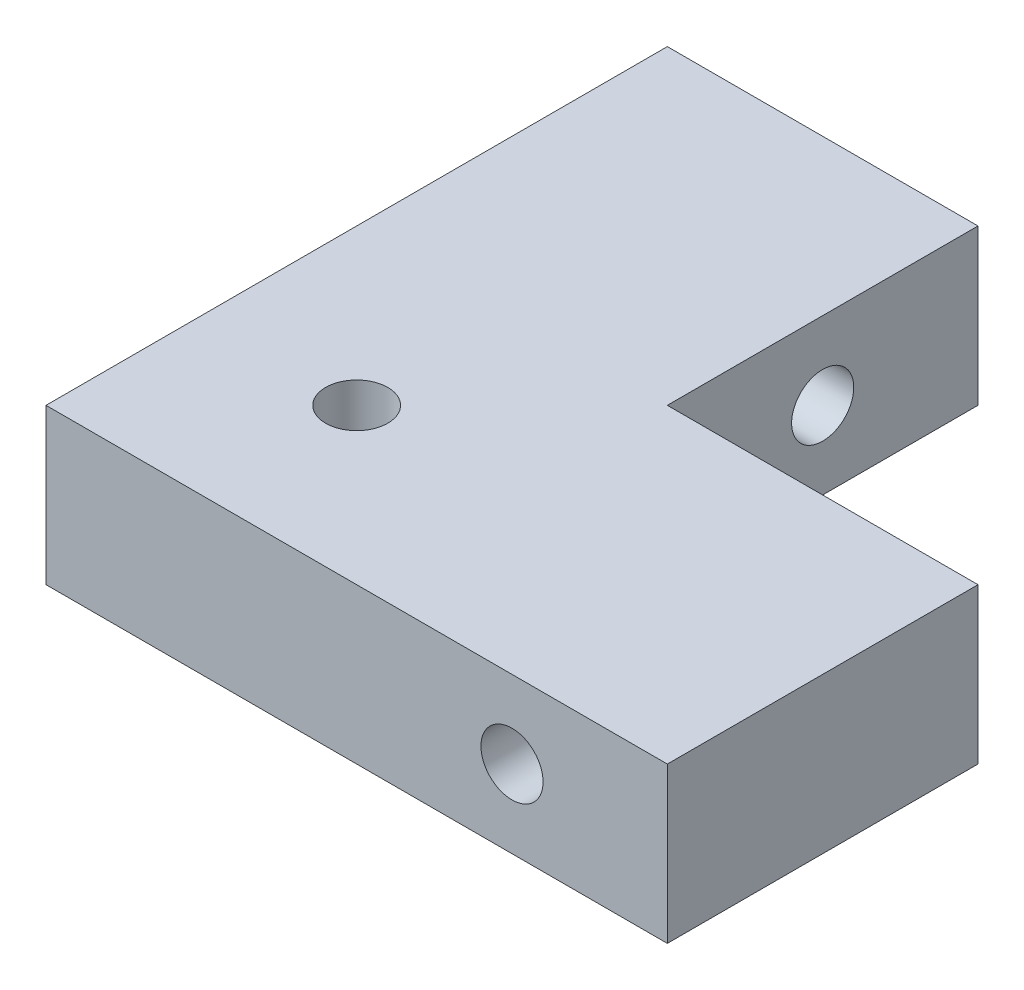
from build123d import *

# Parameters (mm, degrees)
RESSALTO_EXTRUS_O1_DEPTH = 20
ESBO_O3_R                = 4
CORTE_EXTRUS_O1_DEPTH    = 63.524475359
ESBO_O4_R                = 4
CORTE_EXTRUS_O2_DEPTH    = 84.066238629
ESBO_O5_R                = 4
CORTE_EXTRUS_O3_DEPTH    = 85.907655832


with BuildPart() as part:
    # Esboço1 → Ressalto-extrusão1 (new body)
    with BuildSketch(Plane(origin=(0, 0, 0), x_dir=(1, 0, 0), z_dir=(0, 1, 0))):
        Polygon((-70, 36.304347826), (-70, -43.695652174), (10, -43.695652174), (10, -3.695652174), (-30, -3.695652174), (-30, 36.304347826), align=None)
    extrude(amount=RESSALTO_EXTRUS_O1_DEPTH)

    # Esboço3 → Corte-extrusão1 (cut, through all)
    with BuildSketch(Plane(origin=(-30, 0, 0), x_dir=(0, 0, -1), z_dir=(1, 0, 0))):
        with Locations((16.304347826, 10)):
            Circle(ESBO_O3_R)
    extrude(amount=-CORTE_EXTRUS_O1_DEPTH, mode=Mode.SUBTRACT)

    # Esboço4 → Corte-extrusão2 (cut, through all)
    with BuildSketch(Plane(origin=(0, 0, 3.695652174), x_dir=(-1, 0, 0), z_dir=(0, 0, -1))):
        with Locations((10, 10)):
            Circle(ESBO_O4_R)
    extrude(amount=-CORTE_EXTRUS_O2_DEPTH, mode=Mode.SUBTRACT)

    # Esboço5 → Corte-extrusão3 (cut, through all)
    with BuildSketch(Plane.XZ):
        with Locations(Location((-50, 23.695652174, 0), (0, 0, 270))):
            Circle(ESBO_O5_R)
    extrude(amount=-CORTE_EXTRUS_O3_DEPTH, mode=Mode.SUBTRACT)


solid = part.part
